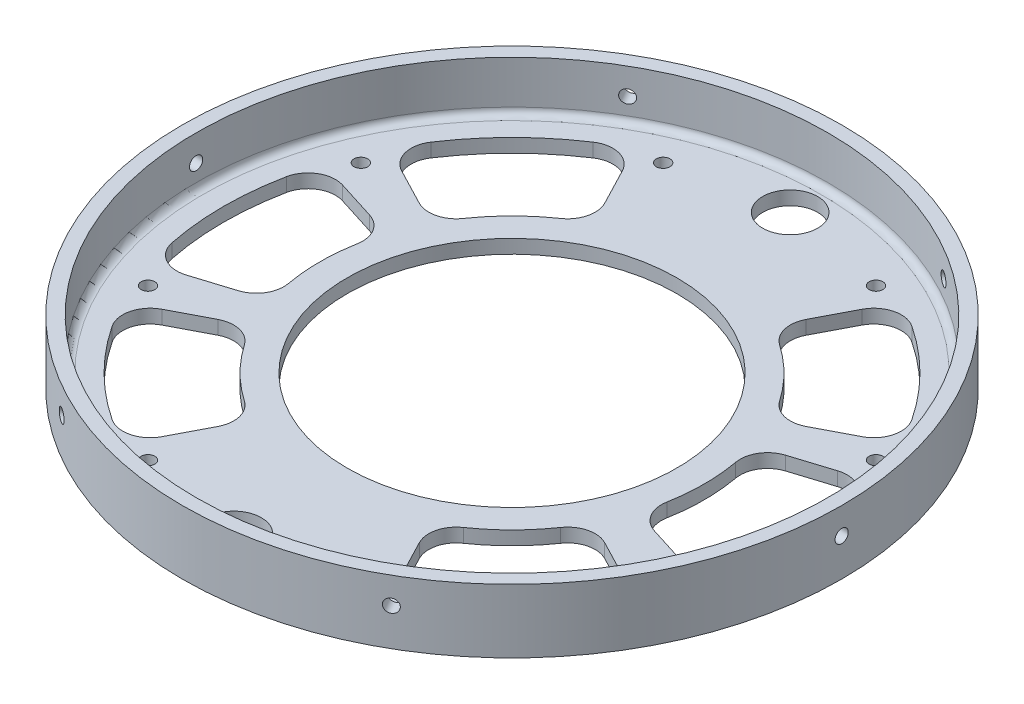
from build123d import *

# Parameters (mm, degrees)
SKETCH1_R           = 76.2
BOSS_EXTRUDE1_DEPTH = 16.256
SHELL1_T            = -3.175
FILLET1_R           = 1.5875
SKETCH2_R           = 38.1
CUT_EXTRUDE1_DEPTH  = 16.256
SKETCH3_R           = 1.524
CUT_EXTRUDE2_DEPTH  = 76.2
CIRPATTERN1_COUNT   = 6
CUT_EXTRUDE4_START  = -1.524
SKETCH5_R           = 76.2
CUT_EXTRUDE4_DEPTH  = 1.524
SKETCH6_R           = 6.35
CUT_EXTRUDE5_DEPTH  = 12.7
SKETCH7_R           = 1.5875
CUT_EXTRUDE6_DEPTH  = 6.35
CUT_EXTRUDE8_DEPTH  = 6.35
CUT_EXTRUDE9_DEPTH  = 6.35


with BuildPart() as part:
    # Sketch1 → Boss-Extrude1 (new body)
    with BuildSketch(Plane(origin=(0, 0, 0), x_dir=(1, 0, 0), z_dir=(0, 1, 0))):
        with Locations(Location((0, 0, 0), (0, 0, 270))):
            Circle(SKETCH1_R)
    extrude(amount=BOSS_EXTRUDE1_DEPTH)

    # Shell1
    shell1_openings = [part.faces().sort_by_distance(p)[0] for p in [
        (0, 16.256, 0),
    ]]
    offset(amount=SHELL1_T, openings=shell1_openings, kind=Kind.INTERSECTION)

    # Fillet1
    fillet1_edges = [part.edges().sort_by_distance(p)[0] for p in [
        (0, 3.175, -73.025),
    ]]
    fillet(fillet1_edges, radius=FILLET1_R)

    # Sketch2 → Cut-Extrude1 (cut)
    with BuildSketch(Plane.XZ):
        with Locations(Location((0, 0, 0), (0, 0, 270))):
            Circle(SKETCH2_R)
    extrude(amount=-CUT_EXTRUDE1_DEPTH, mode=Mode.SUBTRACT)

    # Sketch3 → Cut-Extrude2 (cut)
    with BuildSketch(Plane(origin=(0, 0, 0), x_dir=(0, 0, -1), z_dir=(1, 0, 0))):
        with Locations((0, 8.636)):
            Circle(SKETCH3_R)
    cut_extrude2 = extrude(amount=-CUT_EXTRUDE2_DEPTH, mode=Mode.SUBTRACT)

    # CirPattern1: Cut-Extrude2 ×6 about axis
    cirpattern1_axis = Axis((0, 16.256, 0), (0, -1, 0))
    for i in range(1, CIRPATTERN1_COUNT):
        add(cut_extrude2.rotate(cirpattern1_axis, i * 360 / CIRPATTERN1_COUNT), mode=Mode.SUBTRACT)

    # Sketch5 → Cut-Extrude4 (cut)
    with BuildSketch(Plane(origin=(0, 16.256, 0), x_dir=(1, 0, 0), z_dir=(0, 1, 0)).offset(CUT_EXTRUDE4_START)):
        with Locations(Location((0, 0, 0), (0, 0, 270))):
            Circle(SKETCH5_R)
    extrude(amount=CUT_EXTRUDE4_DEPTH, mode=Mode.SUBTRACT)

    # Sketch6 → Cut-Extrude5 (cut)
    with BuildSketch(Plane(origin=(0, 3.175, 0), x_dir=(1, 0, 0), z_dir=(0, 1, 0))):
        with Locations(Location((0, 64.2874, 0), (0, 0, 270))):
            Circle(SKETCH6_R)
        with Locations(Location((0, -64.2874, 0), (0, 0, 270))):
            Circle(SKETCH6_R)
    extrude(amount=-CUT_EXTRUDE5_DEPTH, mode=Mode.SUBTRACT)

    # Sketch7 → Cut-Extrude6 (cut)
    with BuildSketch(Plane(origin=(0, 3.175, 0), x_dir=(1, 0, 0), z_dir=(0, 1, 0))):
        with Locations(Location((-24.6, 59.525, 0), (0, 0, 270))):
            Circle(SKETCH7_R)
        with Locations(Location((24.6, 59.525, 0), (0, 0, 270))):
            Circle(SKETCH7_R)
        with Locations(Location((24.6, -59.525, 0), (0, 0, 270))):
            Circle(SKETCH7_R)
        with Locations(Location((-24.6, -59.525, 0), (0, 0, 270))):
            Circle(SKETCH7_R)
        with Locations(Location((-59.525, -24.6, 0), (0, 0, 270))):
            Circle(SKETCH7_R)
        with Locations(Location((-59.525, 24.6, 0), (0, 0, 270))):
            Circle(SKETCH7_R)
        with Locations(Location((59.525, 24.6, 0), (0, 0, 270))):
            Circle(SKETCH7_R)
        with Locations(Location((59.525, -24.6, 0), (0, 0, 270))):
            Circle(SKETCH7_R)
    extrude(amount=-CUT_EXTRUDE6_DEPTH, mode=Mode.SUBTRACT)

    # Sketch9 → Cut-Extrude8 (cut)
    with BuildSketch(Plane(origin=(0, 3.175, 0), x_dir=(1, 0, 0), z_dir=(0, 1, 0))):
        with BuildLine():
            Line((-27.700233979, 53.211654386), (-23.272851578, 44.706731925))
            ThreePointArc((-23.272851578, 44.706731925), (-22.741576978, 40.248145008), (-25.292199073, 36.552799702))
            ThreePointArc((-25.292199073, 36.552799702), (-31.430896424, 31.430896424), (-36.552799702, 25.292199073))
            ThreePointArc((-36.552799702, 25.292199073), (-40.248145008, 22.741576978), (-44.706731925, 23.272851578))
            Line((-44.706731925, 23.272851578), (-53.211654386, 27.700233979))
            ThreePointArc((-53.211654386, 27.700233979), (-56.427875079, 31.745110735), (-55.572134976, 36.841463587))
            ThreePointArc((-55.572134976, 36.841463587), (-47.146344636, 47.146344636), (-36.841463587, 55.572134976))
            ThreePointArc((-36.841463587, 55.572134976), (-31.745110735, 56.427875079), (-27.700233979, 53.211654386))
        make_face()
        with BuildLine():
            Line((44.706731925, 23.272851578), (53.211654386, 27.700233979))
            ThreePointArc((53.211654386, 27.700233979), (56.427875079, 31.745110735), (55.572134976, 36.841463587))
            ThreePointArc((55.572134976, 36.841463587), (47.146344636, 47.146344636), (36.841463587, 55.572134976))
            ThreePointArc((36.841463587, 55.572134976), (31.745110735, 56.427875079), (27.700233979, 53.211654386))
            Line((27.700233979, 53.211654386), (23.272851578, 44.706731925))
            ThreePointArc((23.272851578, 44.706731925), (22.741576978, 40.248145008), (25.292199073, 36.552799702))
            ThreePointArc((25.292199073, 36.552799702), (31.430896424, 31.430896424), (36.552799702, 25.292199073))
            ThreePointArc((36.552799702, 25.292199073), (40.248145008, 22.741576978), (44.706731925, 23.272851578))
        make_face()
        with BuildLine():
            Line((27.700233979, -53.211654386), (23.272851578, -44.706731925))
            ThreePointArc((23.272851578, -44.706731925), (22.741576978, -40.248145008), (25.292199073, -36.552799702))
            ThreePointArc((25.292199073, -36.552799702), (31.430896424, -31.430896424), (36.552799702, -25.292199073))
            ThreePointArc((36.552799702, -25.292199073), (40.248145008, -22.741576978), (44.706731925, -23.272851578))
            Line((44.706731925, -23.272851578), (53.211654386, -27.700233979))
            ThreePointArc((53.211654386, -27.700233979), (56.427875079, -31.745110735), (55.572134976, -36.841463587))
            ThreePointArc((55.572134976, -36.841463587), (47.146344636, -47.146344636), (36.841463587, -55.572134976))
            ThreePointArc((36.841463587, -55.572134976), (31.745110735, -56.427875079), (27.700233979, -53.211654386))
        make_face()
        with BuildLine():
            Line((-44.706731925, -23.272851578), (-53.211654386, -27.700233979))
            ThreePointArc((-53.211654386, -27.700233979), (-56.427875079, -31.745110735), (-55.572134976, -36.841463587))
            ThreePointArc((-55.572134976, -36.841463587), (-47.146344636, -47.146344636), (-36.841463587, -55.572134976))
            ThreePointArc((-36.841463587, -55.572134976), (-31.745110735, -56.427875079), (-27.700233979, -53.211654386))
            Line((-27.700233979, -53.211654386), (-23.272851578, -44.706731925))
            ThreePointArc((-23.272851578, -44.706731925), (-22.741576978, -40.248145008), (-25.292199073, -36.552799702))
            ThreePointArc((-25.292199073, -36.552799702), (-31.430896424, -31.430896424), (-36.552799702, -25.292199073))
            ThreePointArc((-36.552799702, -25.292199073), (-40.248145008, -22.741576978), (-44.706731925, -23.272851578))
        make_face()
    extrude(amount=-CUT_EXTRUDE8_DEPTH, mode=Mode.SUBTRACT)

    # Sketch11 → Cut-Extrude9 (cut)
    with BuildSketch(Plane(origin=(0, 3.175, 0), x_dir=(1, 0, 0), z_dir=(0, 1, 0))):
        with BuildLine():
            Line((-48.068824477, 15.156042141), (-57.213344942, 18.039298368))
            ThreePointArc((-57.213344942, 18.039298368), (-62.347716187, 17.453350046), (-65.346282218, 13.244584755))
            ThreePointArc((-65.346282218, 13.244584755), (-66.675, 0), (-65.346282218, -13.244584755))
            ThreePointArc((-65.346282218, -13.244584755), (-62.347716187, -17.453350046), (-57.213344942, -18.039298368))
            Line((-57.213344942, -18.039298368), (-48.068824477, -15.156042141))
            ThreePointArc((-48.068824477, -15.156042141), (-44.540459561, -12.37901297), (-43.731018016, -7.962447065))
            ThreePointArc((-43.731018016, -7.962447065), (-44.45, 0), (-43.731018016, 7.962447065))
            ThreePointArc((-43.731018016, 7.962447065), (-44.540459561, 12.37901297), (-48.068824477, 15.156042141))
        make_face()
        with BuildLine():
            Line((48.068824477, -15.156042141), (57.213344942, -18.039298368))
            ThreePointArc((57.213344942, -18.039298368), (62.347716187, -17.453350046), (65.346282218, -13.244584755))
            ThreePointArc((65.346282218, -13.244584755), (66.675, 0), (65.346282218, 13.244584755))
            ThreePointArc((65.346282218, 13.244584755), (62.347716187, 17.453350046), (57.213344942, 18.039298368))
            Line((57.213344942, 18.039298368), (48.068824477, 15.156042141))
            ThreePointArc((48.068824477, 15.156042141), (44.540459561, 12.37901297), (43.731018016, 7.962447065))
            ThreePointArc((43.731018016, 7.962447065), (44.45, 0), (43.731018016, -7.962447065))
            ThreePointArc((43.731018016, -7.962447065), (44.540459561, -12.37901297), (48.068824477, -15.156042141))
        make_face()
    extrude(amount=-CUT_EXTRUDE9_DEPTH, mode=Mode.SUBTRACT)


solid = part.part
